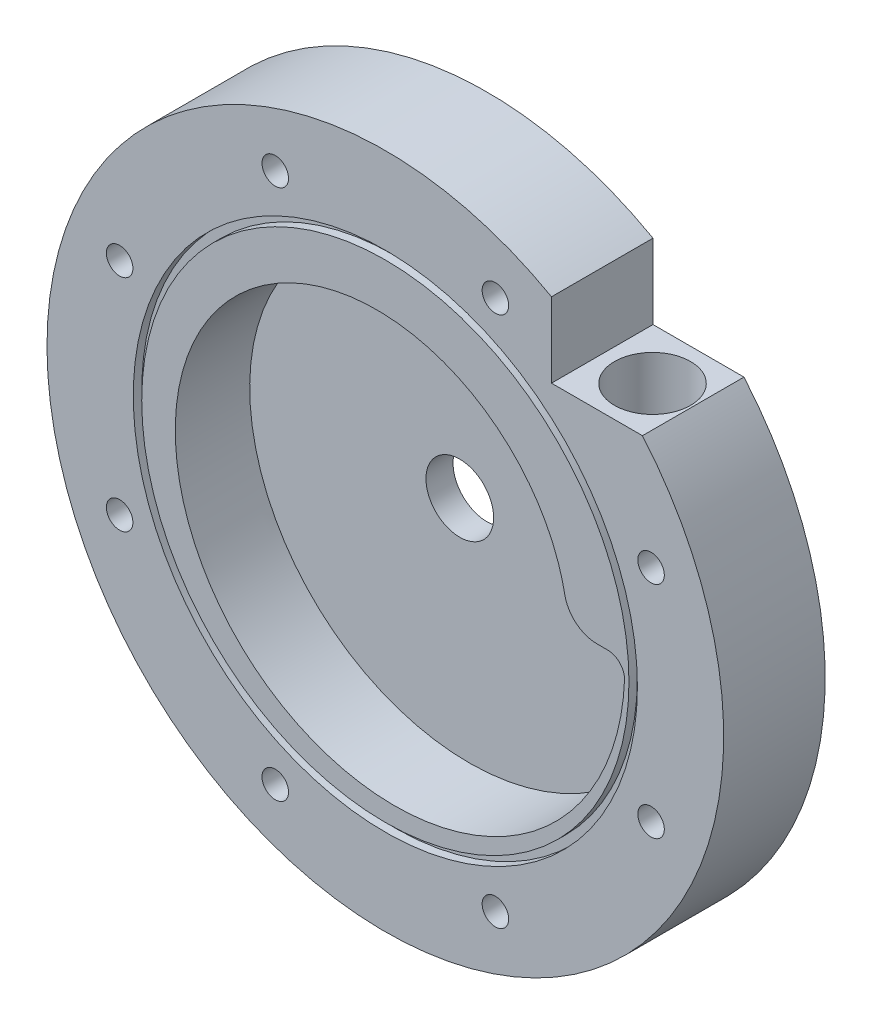
from build123d import *

# Parameters (mm, degrees)
SKETCH1_R                         = 63.5
WALLS_DEPTH                       = 9.07288
FLOOR_START                       = -5.08
SKETCH1_3_R                       = 63.5
SKETCH1_3_R_2                     = 6.35
FLOOR_2_DEPTH                     = 5.08
SKETCH5_R                         = 63.5
CEILING_CONSTRAINT_DEPTH          = 4.89712
SKETCH7_W                         = 17.072268272
SKETCH7_H                         = 19.05
OUTLET_CUT_DEPTH                  = 124.309413921
OUTLET_HOLE_D                     = 9.525
OUTLET_HOLE_DEPTH                 = 40.64
OUTLET_HOLE_TIP                   = 2.861598698
PIPE_TAP_DRILL_FOR_3_8_TAP1_D     = 14.2748
PIPE_TAP_DRILL_FOR_3_8_TAP1_DEPTH = 12.7
PIPE_TAP_DRILL_FOR_3_8_TAP1_TIP   = 4.288582582
SKETCH16_R                        = 47.3075
SKETCH16_R_2                      = 45.72
SEAL_GROOVE_DEPTH                 = 1.5875
FASTENER_HOLES_D                  = 4.9784
CIRPATTERN1_COUNT                 = 8


with BuildPart() as part:
    # Sketch1 → Walls (new body)
    with BuildSketch(Plane.XY):
        Circle(SKETCH1_R)
        with BuildLine():
            Line((39.693365632, 3.175), (41.723742199, 3.175))
            ThreePointArc((41.723742199, 3.175), (43.968806229, 2.24506403), (44.898742199, 0))
            add(Edge.make_bspline(
                [(34.295865632, 0), (34.29882834, 0.071916436), (34.304754577, 0.21576926), (34.311966888, 0.431642324), (34.317934755, 0.647612083), (34.327139988, 1.079917114), (34.332942166, 2.090306576), (34.279898225, 3.607362054), (34.120445155, 5.41030125), (33.880169476, 7.135326628), (33.552885962, 8.849925684), (33.138997804, 10.54970943), (32.639140351, 12.230302519), (32.054174895, 13.887355713), (31.385187056, 15.516557503), (30.633483645, 17.113645751), (29.800589951, 18.674419055), (28.8882464, 20.194747988), (27.898404875, 21.670586138), (26.833224521, 23.097980967), (25.695067067, 24.473084443), (24.486491635, 25.79216345), (23.210249051, 27.051609932), (21.869275652, 28.247950753), (20.466686605, 29.377857252), (19.005768742, 30.438154464), (17.489972932, 31.425829986), (15.922906004, 32.338042467), (14.30832223, 33.172129685), (12.650114403, 33.925616212), (10.95230451, 34.596220626), (9.219034045, 35.18186226), (7.454553956, 35.680667464), (5.663214286, 36.090975363), (3.849453494, 36.411343101), (2.017787512, 36.640550541), (0.172798549, 36.777604421), (-1.680876324, 36.82174194), (-3.538556782, 36.772433779), (-5.395531021, 36.629386524), (-7.247067665, 36.392544506), (-9.088427776, 36.062091031), (-10.914876942, 35.638449008), (-12.721697408, 35.122280961), (-14.504200214, 34.514488429), (-16.257737325, 33.816210747), (-17.977713699, 33.028823219), (-19.659599284, 32.153934663), (-21.298940898, 31.193384362), (-22.891373965, 30.149238397), (-24.43263408, 29.02378539), (-25.918568367, 27.819531655), (-27.345146601, 26.539195761), (-28.708472073, 25.185702541), (-30.004792148, 23.762176529), (-31.230508517, 22.271934869), (-32.382187085, 20.718479685), (-33.456567491, 19.105489956), (-34.450572223, 17.436812889), (-35.361315302, 15.716454831), (-36.186110516, 13.948571725), (-36.92247918, 12.137459144), (-37.568157395, 10.287541924), (-38.121102788, 8.403363415), (-38.579500717, 6.489574383), (-38.941769921, 4.550921586), (-39.206567586, 2.592236057), (-39.372793836, 0.618421113), (-39.439595611, -1.36555987), (-39.406369933, -3.354695889), (-39.272766542, -5.343940927), (-39.038689903, -7.328226707), (-38.704300556, -9.302475561), (-38.270015827, -11.261613379), (-37.736509879, -13.200582609), (-37.104713104, -15.11435526), (-36.375810853, -16.997945903), (-35.551241515, -18.846424601), (-34.632693929, -20.654929769), (-33.622104149, -22.418680905), (-32.521651558, -24.132991168), (-31.333754343, -25.793279776), (-30.061064337, -27.395084183), (-28.706461239, -28.934071999), (-27.273046228, -30.406052641), (-25.764134977, -31.806988658), (-24.18325009, -33.133006716), (-22.534112978, -34.380408214), (-20.820635184, -35.545679488), (-19.046909189, -36.625501594), (-17.217198713, -37.616759627), (-15.335928538, -38.516551562), (-13.407673866, -39.322196576), (-11.437149261, -40.031242854), (-9.429197172, -40.641474829), (-7.388776087, -41.15091985), (-5.32094834, -41.557854256), (-3.230867597, -41.86080884), (-1.123766056, -42.058573678), (0.995058608, -42.150202316), (3.120256518, -42.135015304), (5.246439066, -42.01260305), (7.368192535, -41.782828005), (9.480091844, -41.445826152), (11.576714375, -41.002007803), (13.652653862, -40.452057696), (15.702534288, -39.796934391), (17.72102376, -39.037868953), (19.702848338, -38.176362944), (21.642805765, -37.214185701), (23.535779073, -36.153370925), (25.376750026, -34.996212572), (27.16081237, -33.745260064), (28.883184839, -32.403312824), (30.539223912, -30.973414146), (32.12443625, -29.458844418), (33.634490817, -27.863113704), (35.065230621, -26.189953715), (36.412684063, -24.44330917), (37.673075861, -22.62732858), (38.842837509, -20.746354475), (39.91861725, -18.804913085), (40.897289536, -16.807703518), (41.775963949, -14.759586443), (42.55199355, -12.665572318), (43.22298264, -10.530809183), (43.786793912, -8.360570051), (44.241554967, -6.16023993), (44.571284542, -4.028278167), (44.740560267, -2.440845712), (44.813728039, -1.50376068), (44.839477521, -1.128293226), (44.857032226, -0.846470241), (44.872782179, -0.564469795), (44.886887576, -0.282309503), (44.894790326, -0.094111086), (44.898742199, 0)],
                knots=[0, 0, 0, 0, 0.000870248, 0.001740737, 0.002611466, 0.003482435, 0.006968712, 0.014826916, 0.02182843, 0.028845498, 0.035878186, 0.042926556, 0.049990663, 0.057070561, 0.064166299, 0.071277925, 0.078405484, 0.085549018, 0.092708569, 0.099884178, 0.107075882, 0.11428372, 0.121507729, 0.128747942, 0.136004396, 0.143277124, 0.150566158, 0.157871532, 0.165193276, 0.172531421, 0.179885999, 0.187257038, 0.194644569, 0.202048619, 0.209469218, 0.216906393, 0.224360171, 0.23183058, 0.239317647, 0.246821397, 0.254341857, 0.261879053, 0.269433009, 0.277003751, 0.284591303, 0.292195691, 0.299816937, 0.307455067, 0.315110103, 0.32278207, 0.33047099, 0.338176886, 0.345899781, 0.353639698, 0.361396658, 0.369170685, 0.376961799, 0.384770023, 0.392595378, 0.400437886, 0.408297568, 0.416174444, 0.424068536, 0.431979864, 0.439908449, 0.447854312, 0.455817472, 0.463797949, 0.471795764, 0.479810937, 0.487843486, 0.495893432, 0.503960795, 0.512045592, 0.520147845, 0.52826757, 0.536404789, 0.544559519, 0.552731779, 0.560921587, 0.569128963, 0.577353925, 0.58559649, 0.593856678, 0.602134505, 0.610429991, 0.618743153, 0.627074009, 0.635422576, 0.643788872, 0.652172916, 0.660574723, 0.668994312, 0.677431699, 0.685886903, 0.69435994, 0.702850826, 0.71135958, 0.719886217, 0.728430756, 0.736993211, 0.745573601, 0.754171941, 0.762788249, 0.771422539, 0.78007483, 0.788745137, 0.797433476, 0.806139864, 0.814864316, 0.823606849, 0.832367479, 0.841146221, 0.849943091, 0.858758106, 0.86759128, 0.87644263, 0.885312171, 0.894199918, 0.903105888, 0.912030094, 0.920972554, 0.929933282, 0.938912294, 0.947909603, 0.956925227, 0.96595918, 0.975011476, 0.984082132, 0.992034027, 0.994308583, 0.995446291, 0.996584287, 0.997722571, 0.998861142, 1, 1, 1, 1], degree=3))
            ThreePointArc((34.295865632, 0), (35.407115632, -1.11125), (36.518365632, 0))
            ThreePointArc((36.518365632, 0), (37.448301602, 2.24506403), (39.693365632, 3.175))
        make_face(mode=Mode.SUBTRACT)
    extrude(amount=WALLS_DEPTH)

    # Sketch1<3> → Floor 2 (add)
    with BuildSketch(Plane.XY.offset(FLOOR_START)):
        Circle(SKETCH1_3_R)
        Circle(SKETCH1_3_R_2, mode=Mode.SUBTRACT)
    extrude(amount=FLOOR_2_DEPTH)

    # Sketch5 → Ceiling Constraint (add)
    with BuildSketch(Plane.XY.offset(9.07288)):
        Circle(SKETCH5_R)
        with BuildLine():
            ThreePointArc((33.687612918, 8.123242193), (35.802537749, 4.571401559), (39.693365632, 3.175))
            Line((39.693365632, 3.175), (41.723742199, 3.175))
            ThreePointArc((41.723742199, 3.175), (43.968806229, 2.24506403), (44.898742199, 0))
            add(Edge.make_bspline(
                [(33.687612918, 8.123242193), (33.64058621, 8.364530199), (33.473407427, 9.176333484), (33.138997804, 10.54970943), (32.639140351, 12.230302519), (32.054174895, 13.887355713), (31.385187056, 15.516557503), (30.633483645, 17.113645751), (29.800589951, 18.674419055), (28.8882464, 20.194747988), (27.898404875, 21.670586138), (26.833224521, 23.097980967), (25.695067067, 24.473084443), (24.486491635, 25.79216345), (23.210249051, 27.051609932), (21.869275652, 28.247950753), (20.466686605, 29.377857252), (19.005768742, 30.438154464), (17.489972932, 31.425829986), (15.922906004, 32.338042467), (14.30832223, 33.172129685), (12.650114403, 33.925616212), (10.95230451, 34.596220626), (9.219034045, 35.18186226), (7.454553956, 35.680667464), (5.663214286, 36.090975363), (3.849453494, 36.411343101), (2.017787512, 36.640550541), (0.172798549, 36.777604421), (-1.680876324, 36.82174194), (-3.538556782, 36.772433779), (-5.395531021, 36.629386524), (-7.247067665, 36.392544506), (-9.088427776, 36.062091031), (-10.914876942, 35.638449008), (-12.721697408, 35.122280961), (-14.504200214, 34.514488429), (-16.257737325, 33.816210747), (-17.977713699, 33.028823219), (-19.659599284, 32.153934663), (-21.298940898, 31.193384362), (-22.891373965, 30.149238397), (-24.43263408, 29.02378539), (-25.918568367, 27.819531655), (-27.345146601, 26.539195761), (-28.708472073, 25.185702541), (-30.004792148, 23.762176529), (-31.230508517, 22.271934869), (-32.382187085, 20.718479685), (-33.456567491, 19.105489956), (-34.450572223, 17.436812889), (-35.361315302, 15.716454831), (-36.186110516, 13.948571725), (-36.92247918, 12.137459144), (-37.568157395, 10.287541924), (-38.121102788, 8.403363415), (-38.579500717, 6.489574383), (-38.941769921, 4.550921586), (-39.206567586, 2.592236057), (-39.372793836, 0.618421113), (-39.439595611, -1.36555987), (-39.406369933, -3.354695889), (-39.272766542, -5.343940927), (-39.038689903, -7.328226707), (-38.704300556, -9.302475561), (-38.270015827, -11.261613379), (-37.736509879, -13.200582609), (-37.104713104, -15.11435526), (-36.375810853, -16.997945903), (-35.551241515, -18.846424601), (-34.632693929, -20.654929769), (-33.622104149, -22.418680905), (-32.521651558, -24.132991168), (-31.333754343, -25.793279776), (-30.061064337, -27.395084183), (-28.706461239, -28.934071999), (-27.273046228, -30.406052641), (-25.764134977, -31.806988658), (-24.18325009, -33.133006716), (-22.534112978, -34.380408214), (-20.820635184, -35.545679488), (-19.046909189, -36.625501594), (-17.217198713, -37.616759627), (-15.335928538, -38.516551562), (-13.407673866, -39.322196576), (-11.437149261, -40.031242854), (-9.429197172, -40.641474829), (-7.388776087, -41.15091985), (-5.32094834, -41.557854256), (-3.230867597, -41.86080884), (-1.123766056, -42.058573678), (0.995058608, -42.150202316), (3.120256518, -42.135015304), (5.246439066, -42.01260305), (7.368192535, -41.782828005), (9.480091844, -41.445826152), (11.576714375, -41.002007803), (13.652653862, -40.452057696), (15.702534288, -39.796934391), (17.72102376, -39.037868953), (19.702848338, -38.176362944), (21.642805765, -37.214185701), (23.535779073, -36.153370925), (25.376750026, -34.996212572), (27.16081237, -33.745260064), (28.883184839, -32.403312824), (30.539223912, -30.973414146), (32.12443625, -29.458844418), (33.634490817, -27.863113704), (35.065230621, -26.189953715), (36.412684063, -24.44330917), (37.673075861, -22.62732858), (38.842837509, -20.746354475), (39.91861725, -18.804913085), (40.897289536, -16.807703518), (41.775963949, -14.759586443), (42.55199355, -12.665572318), (43.22298264, -10.530809183), (43.786793912, -8.360570051), (44.241554967, -6.16023993), (44.571284542, -4.028278167), (44.740560267, -2.440845712), (44.813728039, -1.50376068), (44.839477521, -1.128293226), (44.857032226, -0.846470241), (44.872782179, -0.564469795), (44.886887576, -0.282309503), (44.894790326, -0.094111086), (44.898742199, 0)],
                knots=[0.032905983, 0.032905983, 0.032905983, 0.032905983, 0.035878186, 0.042926556, 0.049990663, 0.057070561, 0.064166299, 0.071277925, 0.078405484, 0.085549018, 0.092708569, 0.099884178, 0.107075882, 0.11428372, 0.121507729, 0.128747942, 0.136004396, 0.143277124, 0.150566158, 0.157871532, 0.165193276, 0.172531421, 0.179885999, 0.187257038, 0.194644569, 0.202048619, 0.209469218, 0.216906393, 0.224360171, 0.23183058, 0.239317647, 0.246821397, 0.254341857, 0.261879053, 0.269433009, 0.277003751, 0.284591303, 0.292195691, 0.299816937, 0.307455067, 0.315110103, 0.32278207, 0.33047099, 0.338176886, 0.345899781, 0.353639698, 0.361396658, 0.369170685, 0.376961799, 0.384770023, 0.392595378, 0.400437886, 0.408297568, 0.416174444, 0.424068536, 0.431979864, 0.439908449, 0.447854312, 0.455817472, 0.463797949, 0.471795764, 0.479810937, 0.487843486, 0.495893432, 0.503960795, 0.512045592, 0.520147845, 0.52826757, 0.536404789, 0.544559519, 0.552731779, 0.560921587, 0.569128963, 0.577353925, 0.58559649, 0.593856678, 0.602134505, 0.610429991, 0.618743153, 0.627074009, 0.635422576, 0.643788872, 0.652172916, 0.660574723, 0.668994312, 0.677431699, 0.685886903, 0.69435994, 0.702850826, 0.71135958, 0.719886217, 0.728430756, 0.736993211, 0.745573601, 0.754171941, 0.762788249, 0.771422539, 0.78007483, 0.788745137, 0.797433476, 0.806139864, 0.814864316, 0.823606849, 0.832367479, 0.841146221, 0.849943091, 0.858758106, 0.86759128, 0.87644263, 0.885312171, 0.894199918, 0.903105888, 0.912030094, 0.920972554, 0.929933282, 0.938912294, 0.947909603, 0.956925227, 0.96595918, 0.975011476, 0.984082132, 0.992034027, 0.994308583, 0.995446291, 0.996584287, 0.997722571, 0.998861142, 1, 1, 1, 1], degree=3))
        make_face(mode=Mode.SUBTRACT)
    extrude(amount=CEILING_CONSTRAINT_DEPTH)

    # Sketch7 → Outlet Cut (cut, through all)
    with BuildSketch(Plane(origin=(0, 41.275, 0), x_dir=(-1, 0, 0), z_dir=(0, -1, 0))):
        with Locations((-39.719688052, -4.445)):
            Rectangle(SKETCH7_W, SKETCH7_H)
    extrude(amount=-OUTLET_CUT_DEPTH, mode=Mode.SUBTRACT)

    # Outlet Hole
    with Locations(Plane(origin=(40.708553916, 41.275, 4.53644), x_dir=(0, 0, 1), z_dir=(0, 1, 0))):
        with Locations((0, 0)):
            Hole(OUTLET_HOLE_D / 2, depth=OUTLET_HOLE_DEPTH)
            with Locations((0, 0, -(OUTLET_HOLE_DEPTH + OUTLET_HOLE_TIP / 2))):  # 118° drill point
                Cone(0, OUTLET_HOLE_D / 2, OUTLET_HOLE_TIP, mode=Mode.SUBTRACT)

    # Pipe Tap Drill for 3/8 Tap1
    with Locations(Plane(origin=(0, 41.275, 0), x_dir=(1, 0, 0), z_dir=(0, 1, 0))):
        with Locations((40.708553916, -4.53644)):
            Hole(PIPE_TAP_DRILL_FOR_3_8_TAP1_D / 2, depth=PIPE_TAP_DRILL_FOR_3_8_TAP1_DEPTH)
            with Locations((0, 0, -(PIPE_TAP_DRILL_FOR_3_8_TAP1_DEPTH + PIPE_TAP_DRILL_FOR_3_8_TAP1_TIP / 2))):  # 118° drill point
                Cone(0, PIPE_TAP_DRILL_FOR_3_8_TAP1_D / 2, PIPE_TAP_DRILL_FOR_3_8_TAP1_TIP, mode=Mode.SUBTRACT)

    # Sketch16 → Seal Groove (cut)
    with BuildSketch(Plane.XY.offset(13.97)):
        Circle(SKETCH16_R)
        Circle(SKETCH16_R_2, mode=Mode.SUBTRACT)
    extrude(amount=-SEAL_GROOVE_DEPTH, mode=Mode.SUBTRACT)

    # Fastener Holes (through all)
    with Locations(Plane.XY.offset(13.97)):
        with Locations((49.866397767, 20.655338262)):
            fastener_holes = Hole(FASTENER_HOLES_D / 2)

    # CirPattern1: Fastener Holes ×8 about axis
    cirpattern1_axis = Axis((0, 0, 0), (0, 0, 1))
    for i in range(1, CIRPATTERN1_COUNT):
        add(fastener_holes.rotate(cirpattern1_axis, i * 360 / CIRPATTERN1_COUNT), mode=Mode.SUBTRACT)


solid = part.part
